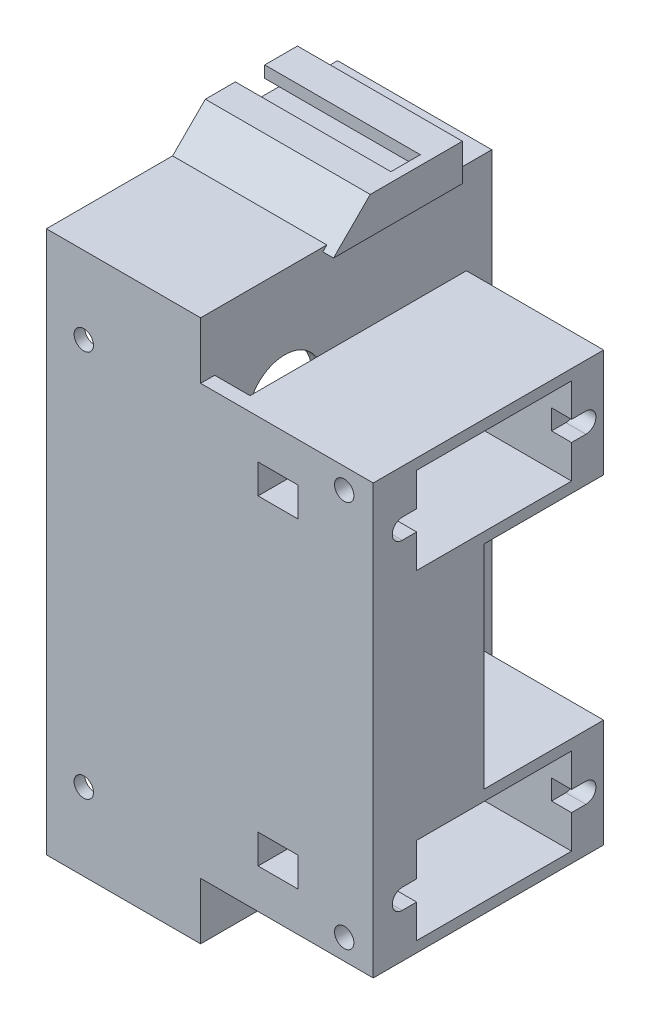
from build123d import *

# Parameters (mm, degrees)
BOSS_EXTRUDE1_START = -88.55
SKETCH1_W           = 43.6
SKETCH1_H           = 81.2
BOSS_EXTRUDE1_DEPTH = 11.55
BOSS_EXTRUDE2_START = 3.45
SKETCH2_W           = 20.55
SKETCH2_H           = 33
BOSS_EXTRUDE2_DEPTH = 7.45
BOSS_EXTRUDE3_START = 4.45
SKETCH3_W           = 6.3
SKETCH3_H           = 13
BOSS_EXTRUDE3_DEPTH = 6.45
BOSS_EXTRUDE4_START = 11.55
SKETCH4_W           = 26.85
SKETCH4_H           = 64.2
BOSS_EXTRUDE4_DEPTH = 1.05
BOSS_EXTRUDE5_START = -61.425
SKETCH5_W           = 32.8
SKETCH5_H           = 16.2
BOSS_EXTRUDE5_DEPTH = 10.275
BOSS_EXTRUDE6_START = -87.75
BOSS_EXTRUDE6_DEPTH = 12.35
BOSS_EXTRUDE7_START = -61.425
SKETCH7_W           = 32.8
SKETCH7_H           = 16.2
BOSS_EXTRUDE7_DEPTH = 10.275
BOSS_EXTRUDE8_START = -87.75
BOSS_EXTRUDE8_DEPTH = 12.35
CUT_EXTRUDE1_START  = -89.3
SKETCH9_W           = 43
SKETCH9_H           = 78
CUT_EXTRUDE1_DEPTH  = 10.8
CUT_EXTRUDE2_START  = 11.5
SKETCH10_R          = 1.45
CUT_EXTRUDE2_DEPTH  = 1.1
CUT_EXTRUDE3_START  = -88.45
CUT_EXTRUDE3_DEPTH  = 11.65
CUT_EXTRUDE4_START  = -59.775
SKETCH12_W          = 23.2
SKETCH12_H          = 13
CUT_EXTRUDE4_DEPTH  = 8.625
CUT_EXTRUDE5_START  = -52.65
SKETCH13_R          = 1.5
CUT_EXTRUDE5_DEPTH  = 1.5
CUT_EXTRUDE6_START  = -52.65
SKETCH14_W          = 2.15
SKETCH14_H          = 3
CUT_EXTRUDE6_DEPTH  = 1.5
CUT_EXTRUDE7_START  = -52.65
SKETCH15_R          = 1.5
CUT_EXTRUDE7_DEPTH  = 1.5
CUT_EXTRUDE8_START  = -52.65
SKETCH16_W          = 2.15
SKETCH16_H          = 3
CUT_EXTRUDE8_DEPTH  = 1.5
CUT_EXTRUDE9_START  = -70.4
SKETCH17_R          = 3.15
CUT_EXTRUDE9_DEPTH  = 1.3
CUT_EXTRUDE10_START = 8.5
SKETCH18_W          = 6
SKETCH18_H          = 4.4
CUT_EXTRUDE10_DEPTH = 2.4
CUT_EXTRUDE11_START = 11.5
SKETCH19_W          = 6
SKETCH19_H          = 4.4
CUT_EXTRUDE11_DEPTH = 1.1
CUT_EXTRUDE12_START = -77.75
SKETCH20_R          = 5.5
CUT_EXTRUDE12_DEPTH = 0.75
CUT_EXTRUDE13_START = -88.45
CUT_EXTRUDE13_DEPTH = 11.65
CUT_EXTRUDE14_START = -59.775
SKETCH22_W          = 23.2
SKETCH22_H          = 13
CUT_EXTRUDE14_DEPTH = 8.625
CUT_EXTRUDE15_START = -52.65
SKETCH23_R          = 1.5
CUT_EXTRUDE15_DEPTH = 1.5
CUT_EXTRUDE16_START = -52.65
SKETCH24_W          = 2.15
SKETCH24_H          = 3
CUT_EXTRUDE16_DEPTH = 1.5
CUT_EXTRUDE17_START = -52.65
SKETCH25_R          = 1.5
CUT_EXTRUDE17_DEPTH = 1.5
CUT_EXTRUDE18_START = -52.65
SKETCH26_W          = 2.15
SKETCH26_H          = 3
CUT_EXTRUDE18_DEPTH = 1.5
CUT_EXTRUDE19_START = -70.4
SKETCH27_R          = 3.15
CUT_EXTRUDE19_DEPTH = 1.3
CUT_EXTRUDE20_START = 8.5
SKETCH28_W          = 6
SKETCH28_H          = 4.4
CUT_EXTRUDE20_DEPTH = 2.4
CUT_EXTRUDE21_START = 11.5
SKETCH29_W          = 6
SKETCH29_H          = 4.4
CUT_EXTRUDE21_DEPTH = 1.1
CUT_EXTRUDE22_START = -77.75
SKETCH30_R          = 5.5
CUT_EXTRUDE22_DEPTH = 0.75


with BuildPart() as part:
    # Sketch1 → Boss-Extrude1 (new, symmetric)
    with BuildSketch(Plane(origin=(0, 0, 0), x_dir=(0, 0, -1), z_dir=(1, 0, 0)).offset(BOSS_EXTRUDE1_START)):
        with Locations((9.2, 0)):
            Rectangle(SKETCH1_W, SKETCH1_H)
    extrude(amount=BOSS_EXTRUDE1_DEPTH, both=True)



with BuildPart() as body_2:
    # Sketch2 → Boss-Extrude2 (new, symmetric)
    with BuildSketch(Plane.XY.offset(BOSS_EXTRUDE2_START)):
        with Locations((-61.425, 0)):
            Rectangle(SKETCH2_W, SKETCH2_H)
    extrude(amount=BOSS_EXTRUDE2_DEPTH, both=True)


with BuildPart() as part_1:
    add(part.part)

    add(body_2.part)  # Boss-Extrude3 merges body 2
    # Sketch3 → Boss-Extrude3 (add, symmetric)
    with BuildSketch(Plane.XY.offset(BOSS_EXTRUDE3_START)):
        with Locations((-74.85, 0)):
            Rectangle(SKETCH3_W, SKETCH3_H)
    extrude(amount=BOSS_EXTRUDE3_DEPTH, both=True)

    # Sketch4 → Boss-Extrude4 (add, symmetric)
    with BuildSketch(Plane.XY.offset(BOSS_EXTRUDE4_START)):
        with Locations((-64.575, 0)):
            Rectangle(SKETCH4_W, SKETCH4_H)
    extrude(amount=BOSS_EXTRUDE4_DEPTH, both=True)

    # Sketch5 → Boss-Extrude5 (add, symmetric)
    with BuildSketch(Plane(origin=(0, 0, 0), x_dir=(0, 0, -1), z_dir=(1, 0, 0)).offset(BOSS_EXTRUDE5_START)):
        with Locations((5.5, 24)):
            Rectangle(SKETCH5_W, SKETCH5_H)
    extrude(amount=BOSS_EXTRUDE5_DEPTH, both=True)

    # Sketch6 → Boss-Extrude6 (add, symmetric)
    with BuildSketch(Plane(origin=(0, 0, 0), x_dir=(0, 0, -1), z_dir=(1, 0, 0)).offset(BOSS_EXTRUDE6_START)):
        Polygon((25, 40), (25, 45.5), (11.2, 45.5), (5.7, 40), align=None)
    extrude(amount=BOSS_EXTRUDE6_DEPTH, both=True)

    # Sketch7 → Boss-Extrude7 (add, symmetric)
    with BuildSketch(Plane(origin=(0, 0, 0), x_dir=(0, 0, -1), z_dir=(1, 0, 0)).offset(BOSS_EXTRUDE7_START)):
        with Locations((5.5, -24)):
            Rectangle(SKETCH7_W, SKETCH7_H)
    extrude(amount=BOSS_EXTRUDE7_DEPTH, both=True)

    # Sketch8 → Boss-Extrude8 (add, symmetric)
    with BuildSketch(Plane(origin=(0, 0, 0), x_dir=(0, 0, -1), z_dir=(1, 0, 0)).offset(BOSS_EXTRUDE8_START)):
        Polygon((25, -40), (25, -45.5), (11.2, -45.5), (5.7, -40), align=None)
    extrude(amount=BOSS_EXTRUDE8_DEPTH, both=True)

    # Sketch9 → Cut-Extrude1 (cut, symmetric)
    with BuildSketch(Plane(origin=(0, 0, 0), x_dir=(0, 0, -1), z_dir=(1, 0, 0)).offset(CUT_EXTRUDE1_START)):
        with Locations((10.5, 0)):
            Rectangle(SKETCH9_W, SKETCH9_H)
    extrude(amount=CUT_EXTRUDE1_DEPTH, both=True, mode=Mode.SUBTRACT)

    # Sketch10 → Cut-Extrude2 (cut, symmetric)
    with BuildSketch(Plane.XY.offset(CUT_EXTRUDE2_START)):
        with Locations((-94.5, -29)):
            Circle(SKETCH10_R)
        with Locations((-94.5, 29)):
            Circle(SKETCH10_R)
        with Locations((-55.5, -29)):
            Circle(SKETCH10_R)
        with Locations((-55.5, 29)):
            Circle(SKETCH10_R)
    extrude(amount=CUT_EXTRUDE2_DEPTH, both=True, mode=Mode.SUBTRACT)

    # Sketch11 → Cut-Extrude3 (cut, symmetric)
    with BuildSketch(Plane(origin=(0, 0, 0), x_dir=(0, 0, -1), z_dir=(1, 0, 0)).offset(CUT_EXTRUDE3_START)):
        Polygon((20.1, 45.5), (15.7, 45.5), (15.7, 43.75), (13.55, 41.6), (22.25, 41.6), (20.1, 43.75), align=None)
    extrude(amount=CUT_EXTRUDE3_DEPTH, both=True, mode=Mode.SUBTRACT)

    # Sketch12 → Cut-Extrude4 (cut, symmetric)
    with BuildSketch(Plane(origin=(0, 0, 0), x_dir=(0, 0, -1), z_dir=(1, 0, 0)).offset(CUT_EXTRUDE4_START)):
        with Locations((5.5, 24)):
            Rectangle(SKETCH12_W, SKETCH12_H)
    extrude(amount=CUT_EXTRUDE4_DEPTH, both=True, mode=Mode.SUBTRACT)

    # Sketch13 → Cut-Extrude5 (cut, symmetric)
    with BuildSketch(Plane(origin=(0, 0, 0), x_dir=(0, 0, -1), z_dir=(1, 0, 0)).offset(CUT_EXTRUDE5_START)):
        with Locations((19.25, 24)):
            Circle(SKETCH13_R)
    extrude(amount=CUT_EXTRUDE5_DEPTH, both=True, mode=Mode.SUBTRACT)

    # Sketch14 → Cut-Extrude6 (cut, symmetric)
    with BuildSketch(Plane(origin=(0, 0, 0), x_dir=(0, 0, -1), z_dir=(1, 0, 0)).offset(CUT_EXTRUDE6_START)):
        with Locations((18.175, 24)):
            Rectangle(SKETCH14_W, SKETCH14_H)
    extrude(amount=CUT_EXTRUDE6_DEPTH, both=True, mode=Mode.SUBTRACT)

    # Sketch15 → Cut-Extrude7 (cut, symmetric)
    with BuildSketch(Plane(origin=(0, 0, 0), x_dir=(0, 0, -1), z_dir=(1, 0, 0)).offset(CUT_EXTRUDE7_START)):
        with Locations((-8.25, 24)):
            Circle(SKETCH15_R)
    extrude(amount=CUT_EXTRUDE7_DEPTH, both=True, mode=Mode.SUBTRACT)

    # Sketch16 → Cut-Extrude8 (cut, symmetric)
    with BuildSketch(Plane(origin=(0, 0, 0), x_dir=(0, 0, -1), z_dir=(1, 0, 0)).offset(CUT_EXTRUDE8_START)):
        with Locations((-7.175, 24)):
            Rectangle(SKETCH16_W, SKETCH16_H)
    extrude(amount=CUT_EXTRUDE8_DEPTH, both=True, mode=Mode.SUBTRACT)

    # Sketch17 → Cut-Extrude9 (cut, symmetric)
    with BuildSketch(Plane(origin=(0, 0, 0), x_dir=(0, 0, -1), z_dir=(1, 0, 0)).offset(CUT_EXTRUDE9_START)):
        with Locations((0, 24)):
            Circle(SKETCH17_R)
    extrude(amount=CUT_EXTRUDE9_DEPTH, both=True, mode=Mode.SUBTRACT)

    # Sketch18 → Cut-Extrude10 (cut, symmetric)
    with BuildSketch(Plane.XY.offset(CUT_EXTRUDE10_START)):
        with Locations((-65.4, 24)):
            Rectangle(SKETCH18_W, SKETCH18_H)
    extrude(amount=CUT_EXTRUDE10_DEPTH, both=True, mode=Mode.SUBTRACT)

    # Sketch19 → Cut-Extrude11 (cut, symmetric)
    with BuildSketch(Plane.XY.offset(CUT_EXTRUDE11_START)):
        with Locations((-65.4, 24)):
            Rectangle(SKETCH19_W, SKETCH19_H)
    extrude(amount=CUT_EXTRUDE11_DEPTH, both=True, mode=Mode.SUBTRACT)

    # Sketch20 → Cut-Extrude12 (cut, symmetric)
    with BuildSketch(Plane(origin=(0, 0, 0), x_dir=(0, 0, -1), z_dir=(1, 0, 0)).offset(CUT_EXTRUDE12_START)):
        with Locations((0, 24)):
            Circle(SKETCH20_R)
    extrude(amount=CUT_EXTRUDE12_DEPTH, both=True, mode=Mode.SUBTRACT)

    # Sketch21 → Cut-Extrude13 (cut, symmetric)
    with BuildSketch(Plane(origin=(0, 0, 0), x_dir=(0, 0, -1), z_dir=(1, 0, 0)).offset(CUT_EXTRUDE13_START)):
        Polygon((20.1, -45.5), (15.7, -45.5), (15.7, -43.75), (13.55, -41.6), (22.25, -41.6), (20.1, -43.75), align=None)
    extrude(amount=CUT_EXTRUDE13_DEPTH, both=True, mode=Mode.SUBTRACT)

    # Sketch22 → Cut-Extrude14 (cut, symmetric)
    with BuildSketch(Plane(origin=(0, 0, 0), x_dir=(0, 0, -1), z_dir=(1, 0, 0)).offset(CUT_EXTRUDE14_START)):
        with Locations((5.5, -24)):
            Rectangle(SKETCH22_W, SKETCH22_H)
    extrude(amount=CUT_EXTRUDE14_DEPTH, both=True, mode=Mode.SUBTRACT)

    # Sketch23 → Cut-Extrude15 (cut, symmetric)
    with BuildSketch(Plane(origin=(0, 0, 0), x_dir=(0, 0, -1), z_dir=(1, 0, 0)).offset(CUT_EXTRUDE15_START)):
        with Locations((19.25, -24)):
            Circle(SKETCH23_R)
    extrude(amount=CUT_EXTRUDE15_DEPTH, both=True, mode=Mode.SUBTRACT)

    # Sketch24 → Cut-Extrude16 (cut, symmetric)
    with BuildSketch(Plane(origin=(0, 0, 0), x_dir=(0, 0, -1), z_dir=(1, 0, 0)).offset(CUT_EXTRUDE16_START)):
        with Locations((18.175, -24)):
            Rectangle(SKETCH24_W, SKETCH24_H)
    extrude(amount=CUT_EXTRUDE16_DEPTH, both=True, mode=Mode.SUBTRACT)

    # Sketch25 → Cut-Extrude17 (cut, symmetric)
    with BuildSketch(Plane(origin=(0, 0, 0), x_dir=(0, 0, -1), z_dir=(1, 0, 0)).offset(CUT_EXTRUDE17_START)):
        with Locations((-8.25, -24)):
            Circle(SKETCH25_R)
    extrude(amount=CUT_EXTRUDE17_DEPTH, both=True, mode=Mode.SUBTRACT)

    # Sketch26 → Cut-Extrude18 (cut, symmetric)
    with BuildSketch(Plane(origin=(0, 0, 0), x_dir=(0, 0, -1), z_dir=(1, 0, 0)).offset(CUT_EXTRUDE18_START)):
        with Locations((-7.175, -24)):
            Rectangle(SKETCH26_W, SKETCH26_H)
    extrude(amount=CUT_EXTRUDE18_DEPTH, both=True, mode=Mode.SUBTRACT)

    # Sketch27 → Cut-Extrude19 (cut, symmetric)
    with BuildSketch(Plane(origin=(0, 0, 0), x_dir=(0, 0, -1), z_dir=(1, 0, 0)).offset(CUT_EXTRUDE19_START)):
        with Locations((0, -24)):
            Circle(SKETCH27_R)
    extrude(amount=CUT_EXTRUDE19_DEPTH, both=True, mode=Mode.SUBTRACT)

    # Sketch28 → Cut-Extrude20 (cut, symmetric)
    with BuildSketch(Plane.XY.offset(CUT_EXTRUDE20_START)):
        with Locations((-65.4, -24)):
            Rectangle(SKETCH28_W, SKETCH28_H)
    extrude(amount=CUT_EXTRUDE20_DEPTH, both=True, mode=Mode.SUBTRACT)

    # Sketch29 → Cut-Extrude21 (cut, symmetric)
    with BuildSketch(Plane.XY.offset(CUT_EXTRUDE21_START)):
        with Locations((-65.4, -24)):
            Rectangle(SKETCH29_W, SKETCH29_H)
    extrude(amount=CUT_EXTRUDE21_DEPTH, both=True, mode=Mode.SUBTRACT)

    # Sketch30 → Cut-Extrude22 (cut, symmetric)
    with BuildSketch(Plane(origin=(0, 0, 0), x_dir=(0, 0, -1), z_dir=(1, 0, 0)).offset(CUT_EXTRUDE22_START)):
        with Locations((0, -24)):
            Circle(SKETCH30_R)
    extrude(amount=CUT_EXTRUDE22_DEPTH, both=True, mode=Mode.SUBTRACT)


solid = part_1.part
